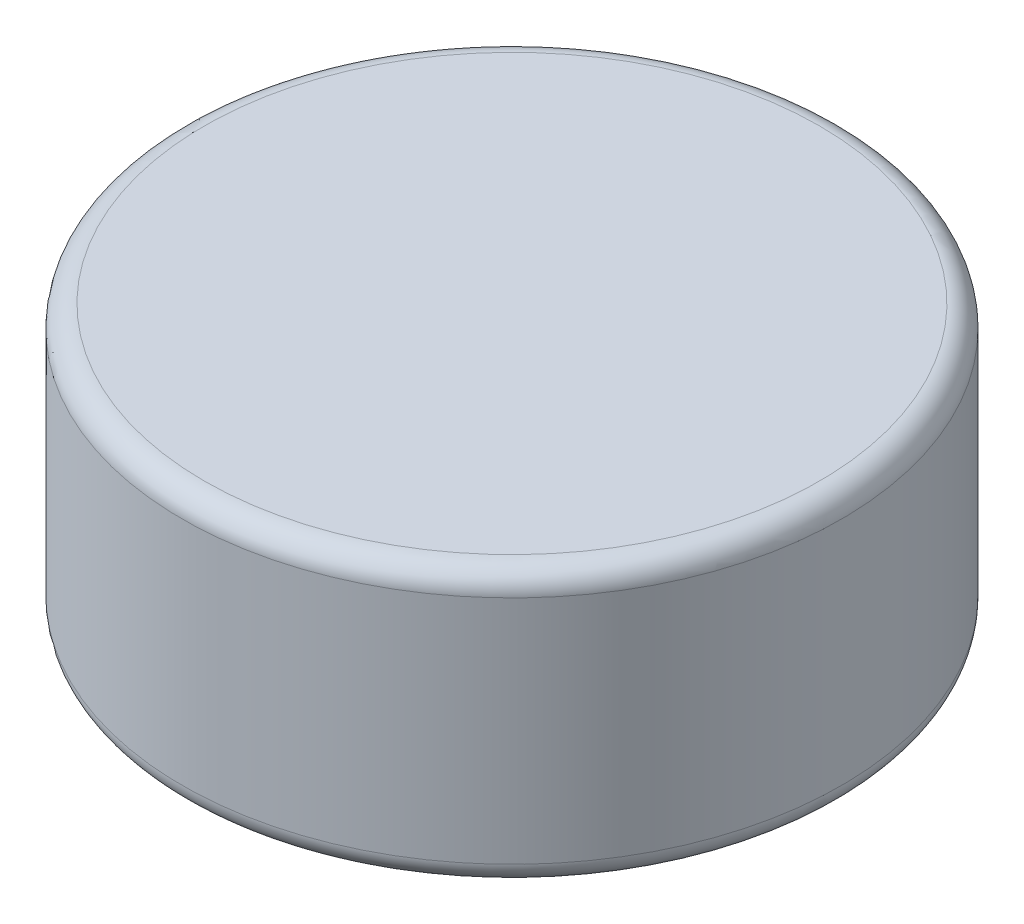
from build123d import *


with BuildPart() as part:
    # Sketch1 → Revolve1 (revolve)
    with BuildSketch(Plane.XY, mode=Mode.PRIVATE) as revolve1_sk:
        with BuildLine():
            Line((2.8, 1.25), (0, 1.25))
            Line((0, 1.25), (0, -1.25))
            Line((0, -1.25), (2.8, -1.25))
            ThreePointArc((2.8, -1.25), (2.941421356, -1.191421356), (3, -1.05))
            Line((3, -1.05), (3, 1.05))
            ThreePointArc((3, 1.05), (2.941421356, 1.191421356), (2.8, 1.25))
        make_face()
    revolve(revolve1_sk.sketch.rotate(Axis((0, 1.25, 0), (0, -1, 0)), 270), axis=Axis((0, 1.25, 0), (0, -1, 0)))


solid = part.part
